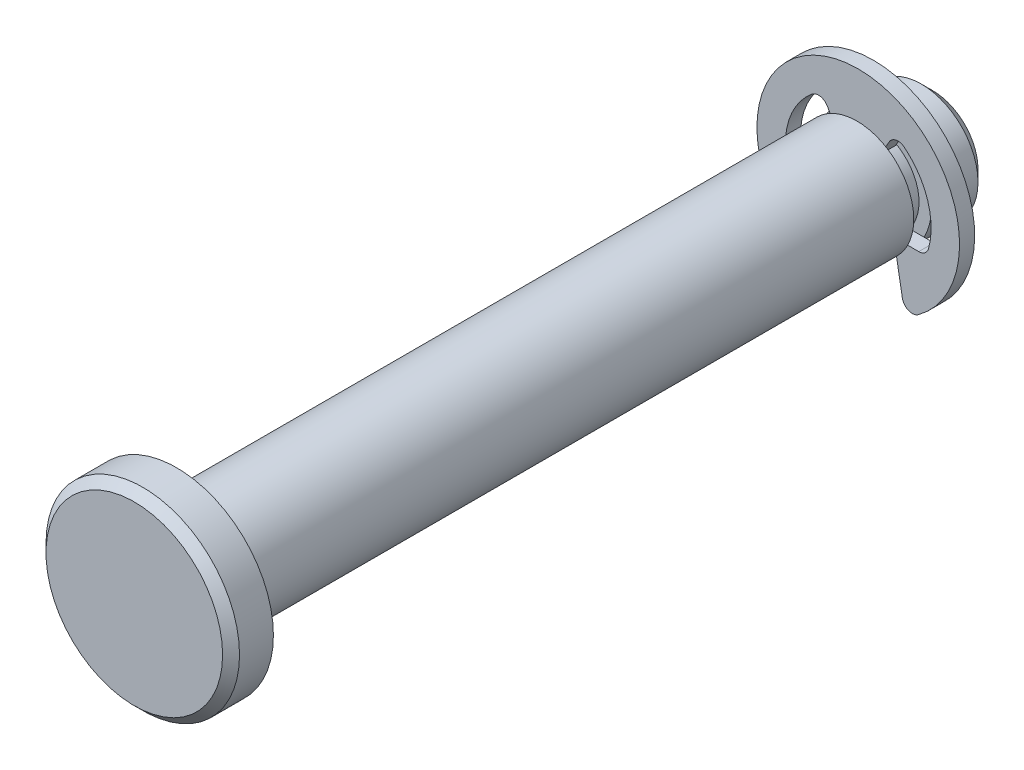
from build123d import *

# Parameters (mm, degrees)
SKETCH2_R      = 2.38125
EXTRUDE1_DEPTH = 15.875
SKETCH3_W      = 0.7366
SKETCH3_H      = 0.51435
SKETCH8_R      = 4.064
EXTRUDE6_DEPTH = 1.778
CHAMFER2_SIZE  = 0.3556
SKETCH4_R      = 4.2545
SKETCH4_R_2    = 1.8669
EXTRUDE2_DEPTH = 0.3175
EXTRUDE4_DEPTH = 19.650199717
EXTRUDE5_DEPTH = 0.635
FILLET1_R      = 0.42545
CHAMFER1_SIZE  = 0.47625


with BuildPart() as part:
    # Sketch2 → Extrude1 (new, symmetric)
    with BuildSketch(Plane.XY):
        Circle(SKETCH2_R)
    extrude(amount=EXTRUDE1_DEPTH, both=True)

    # Sketch3 → Cut-Revolve1 (revolve, cut)
    with BuildSketch(Plane(origin=(0, 0, 0), x_dir=(0, 0, -1), z_dir=(1, 0, 0)), mode=Mode.PRIVATE) as cut_revolve1_sk:
        with Locations((13.0683, 2.124075)):
            Rectangle(SKETCH3_W, SKETCH3_H)
    revolve(cut_revolve1_sk.sketch.rotate(Axis((0, 0, 15.875), (0, 0, -1)), 90), axis=Axis((0, 0, 15.875), (0, 0, -1)), mode=Mode.SUBTRACT)

    # Sketch8 → Extrude6 (add)
    with BuildSketch(Plane.XY.offset(15.875)):
        Circle(SKETCH8_R)
    extrude(amount=EXTRUDE6_DEPTH)

    # Chamfer2
    chamfer2_edges = [part.edges().sort_by_distance(p)[0] for p in [
        (-4.064, 0, 17.653),
    ]]
    chamfer(chamfer2_edges, length=CHAMFER2_SIZE)

    # Chamfer1
    chamfer1_edges = [part.edges().sort_by_distance(p)[0] for p in [
        (-2.38125, 0, -15.875),
    ]]
    chamfer(chamfer1_edges, length=CHAMFER1_SIZE)


with BuildPart() as body_2:
    # Sketch4 → Extrude2 (new, symmetric)
    with BuildSketch(Plane.XY.offset(-13.0683)):
        Circle(SKETCH4_R)
        Circle(SKETCH4_R_2, mode=Mode.SUBTRACT)
    extrude(amount=EXTRUDE2_DEPTH, both=True)

    # Sketch5 → Extrude4 (cut, through all)
    with BuildSketch(Plane.XY):
        with BuildLine():
            Line((-1.53035, 2.650643953), (0, 0))
            Line((0, 0), (1.53035, 2.650643953))
            ThreePointArc((1.53035, 2.650643953), (2.889287878, 1.00990101), (2.84836284, -1.12014))
            Line((2.84836284, -1.12014), (1.49352, -1.12014))
            Line((1.49352, -1.12014), (1.96168838, -3.775254819))
            ThreePointArc((1.96168838, -3.775254819), (0, -4.2545), (-1.96168838, -3.775254819))
            Line((-1.96168838, -3.775254819), (-1.49352, -1.12014))
            Line((-1.49352, -1.12014), (-2.84836284, -1.12014))
            ThreePointArc((-2.84836284, -1.12014), (-2.889287878, 1.00990101), (-1.53035, 2.650643953))
        make_face()
    extrude(amount=-EXTRUDE4_DEPTH, mode=Mode.SUBTRACT)

    # Sketch6 → Extrude5 (add)
    with BuildSketch(Plane.XY.offset(-12.7508)):
        with BuildLine():
            Line((-0.93345, 1.616782826), (0.93345, 1.616782826))
            ThreePointArc((0.93345, 1.616782826), (0, 1.8669), (-0.93345, 1.616782826))
        make_face()
    extrude(amount=-EXTRUDE5_DEPTH)

    # Fillet1
    fillet1_edges = [body_2.edges().sort_by_distance(p)[0] for p in [
        (1.53035, 2.650643953, -13.0683),
        (1.96168838, -3.775254819, -13.0683),
        (-2.84836284, -1.12014, -13.0683),
        (2.84836284, -1.12014, -13.0683),
        (-1.96168838, -3.775254819, -13.0683),
        (-1.53035, 2.650643953, -13.0683),
    ]]
    fillet(fillet1_edges, radius=FILLET1_R)


solid = Compound([part.part, body_2.part])
